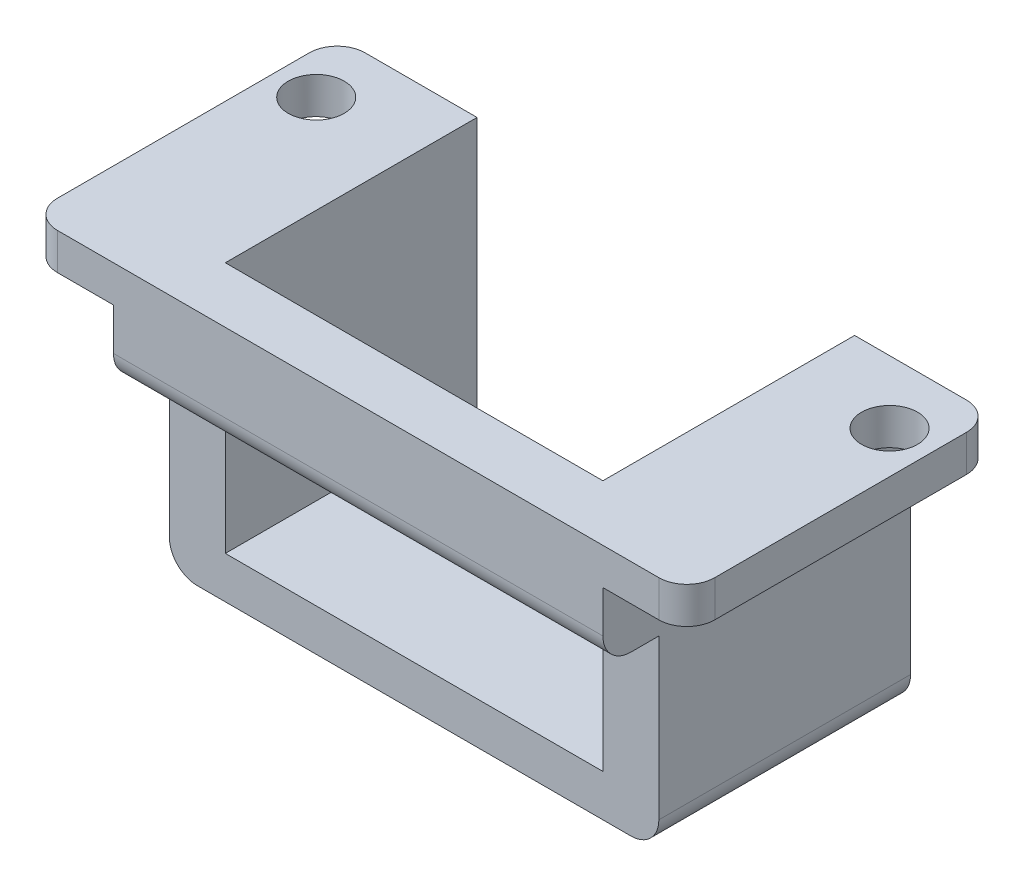
from build123d import *

# Parameters (mm, degrees)
BOSS_EXTRUDE1_DEPTH = 9
SKETCH2_R           = 2
CUT_EXTRUDE1_DEPTH  = 9
BOSS_EXTRUDE2_DEPTH = 9
SKETCH5_W           = 47
SKETCH5_H           = 2.614456703
BOSS_EXTRUDE3_DEPTH = 4
FILLET1_R           = 2
FILLET4_R           = 2
BOSS_EXTRUDE5_DEPTH = 5
FILLET5_R           = 2


with BuildPart() as part:
    # Sketch1 → Boss-Extrude1 (new body)
    with BuildSketch(Plane.XY):
        Polygon((0, 0), (10, 0), (10, -18), (37, -18), (37, 0), (47, 0), (47, -2.614456703), (41, -2.614456703), (41, -21), (6, -21), (6, -2.614456703), (0, -2.614456703), align=None)
    extrude(amount=BOSS_EXTRUDE1_DEPTH)

    # Sketch2 → Cut-Extrude1 (cut)
    with BuildSketch(Plane.XZ.offset(2.614456703)):
        with Locations((3, 4.5)):
            Circle(SKETCH2_R)
    cut_extrude1 = extrude(amount=-CUT_EXTRUDE1_DEPTH, mode=Mode.SUBTRACT)

    # Mirror1: Cut-Extrude1 across plane
    add(cut_extrude1.mirror(Plane(origin=(23.5, 0, 0), x_dir=(0, 0, 1), z_dir=(1, 0, 0))), mode=Mode.SUBTRACT)

    # Sketch3 → Boss-Extrude2 (add)
    with BuildSketch(Plane.XY.offset(9)):
        Polygon((0, 0), (0, -2.614456703), (6, -2.614456703), (6, -21), (41, -21), (41, -2.614456703), (47, -2.614456703), (47, 0), (37, 0), (37, -18), (10, -18), (10, 0), align=None)
    extrude(amount=BOSS_EXTRUDE2_DEPTH)

    # Sketch5 → Boss-Extrude3 (add)
    with BuildSketch(Plane.XY.offset(18)):
        with Locations((23.5, -1.307228352)):
            Rectangle(SKETCH5_W, SKETCH5_H)
    extrude(amount=BOSS_EXTRUDE3_DEPTH)

    # Fillet1
    fillet1_edges = [part.edges().sort_by_distance(p)[0] for p in [
        (0, -1.307228352, 22),
        (47, -1.307228352, 22),
    ]]
    fillet(fillet1_edges, radius=FILLET1_R)

    # Fillet4
    fillet4_edges = [part.edges().sort_by_distance(p)[0] for p in [
        (47, -1.307228352, 0),
        (0, -1.307228352, 0),
        (41, -21, 9),
        (6, -21, 9),
    ]]
    fillet(fillet4_edges, radius=FILLET4_R)

    # Sketch9 → Boss-Extrude5 (add)
    with BuildSketch(Plane.XZ.offset(2.614456703)):
        Polygon((6, 22), (6, 18), (10, 18), (37, 18), (41, 18), (41, 22), align=None)
    extrude(amount=BOSS_EXTRUDE5_DEPTH)

    # Fillet5
    fillet5_edges = [part.edges().sort_by_distance(p)[0] for p in [
        (23.5, -7.614456703, 22),
    ]]
    fillet(fillet5_edges, radius=FILLET5_R)


solid = part.part
